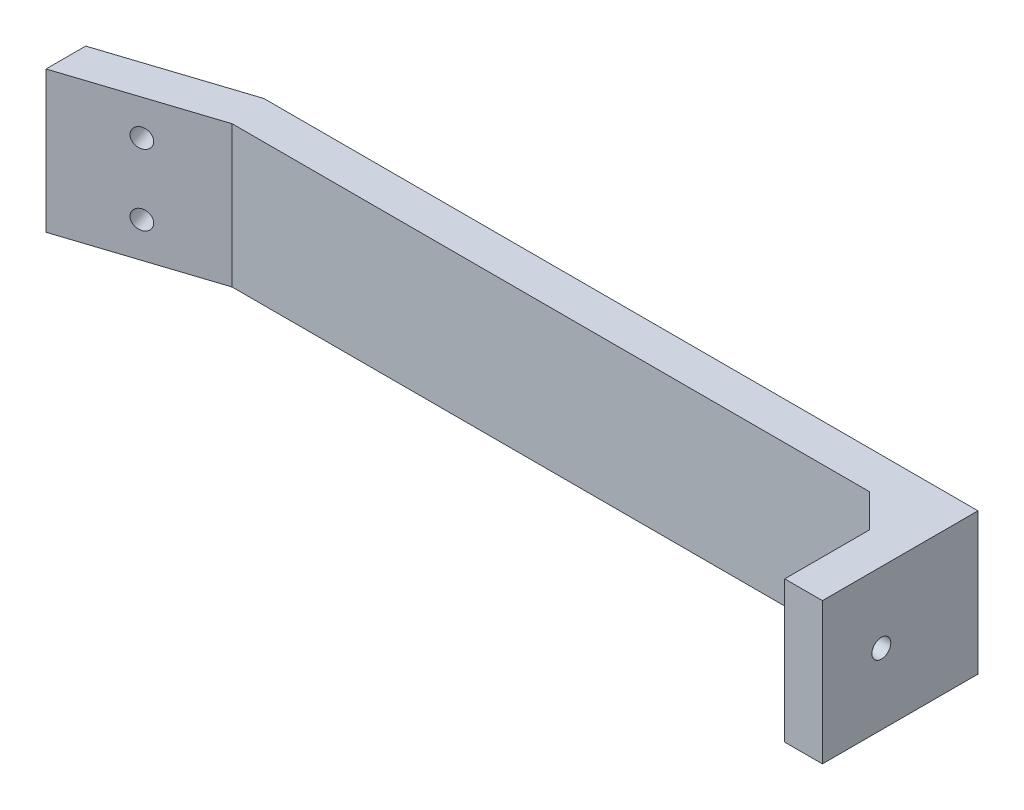
from build123d import *

# Parameters (mm, degrees)
SKETCH1_W           = 180
SKETCH1_H           = 30
BOSS_EXTRUDE1_DEPTH = 50
CUT_EXTRUDE1_DEPTH  = 108.238052948
CUT_EXTRUDE2_DEPTH  = 108.238052948
SKETCH4_W           = 8
SKETCH4_H           = 30
BOSS_EXTRUDE2_DEPTH = 25
SKETCH5_W           = 7
SKETCH5_H           = 5
BOSS_EXTRUDE3_DEPTH = 7
CUT_EXTRUDE3_DEPTH  = 101.444014257
SKETCH7_R           = 2
CUT_EXTRUDE4_DEPTH  = 15
SKETCH8_R           = 2
CUT_EXTRUDE5_DEPTH  = 110.652369188


with BuildPart() as part:
    # Sketch1 → Boss-Extrude1 (new body)
    with BuildSketch(Plane.XY):
        Rectangle(SKETCH1_W, SKETCH1_H)
    extrude(amount=BOSS_EXTRUDE1_DEPTH)

    # Sketch2 → Cut-Extrude1 (cut, through all)
    with BuildSketch(Plane.XZ.offset(15)):
        Polygon((-90, 9.270509831), (-61.468304511, 0), (-90, 0), align=None)
    extrude(amount=-CUT_EXTRUDE1_DEPTH, mode=Mode.SUBTRACT)

    # Sketch3 → Cut-Extrude2 (cut, through all)
    with BuildSketch(Plane.XZ.offset(15)):
        Polygon((-90, 17.682207625), (-60.201228989, 8), (90, 8), (90, 50), (-90, 50), align=None)
    extrude(amount=-CUT_EXTRUDE2_DEPTH, mode=Mode.SUBTRACT)

    # Sketch4 → Boss-Extrude2 (add)
    with BuildSketch(Plane.XY.offset(8)):
        with Locations((86, 0)):
            Rectangle(SKETCH4_W, SKETCH4_H)
    extrude(amount=BOSS_EXTRUDE2_DEPTH)

    # Sketch5 → Boss-Extrude3 (add)
    with BuildSketch(Plane.ZY.offset(-82)):
        with Locations((11.5, -12.5)):
            Rectangle(SKETCH5_W, SKETCH5_H)
        with Locations((11.5, 12.5)):
            Rectangle(SKETCH5_W, SKETCH5_H)
    extrude(amount=BOSS_EXTRUDE3_DEPTH)

    # Sketch6 → Cut-Extrude3 (cut, through all)
    with BuildSketch(Plane.XZ.offset(15)):
        Polygon((75, 8), (82, 15), (75, 15), align=None)
    extrude(amount=-CUT_EXTRUDE3_DEPTH, mode=Mode.SUBTRACT)

    # Sketch7 → Cut-Extrude4 (cut)
    with BuildSketch(Plane.ZY.offset(-82)):
        with Locations((20.5, 0)):
            Circle(SKETCH7_R)
    extrude(amount=-CUT_EXTRUDE4_DEPTH, mode=Mode.SUBTRACT)

    # Sketch8 → Cut-Extrude5 (cut, through all)
    with BuildSketch(Plane(origin=(-5.869700773, 0, -18.065081438), x_dir=(-0.9510565162951532, 0, 0.30901699437494884), z_dir=(-0.30901699437494884, 0, -0.9510565162951532))):
        with Locations((74.92439222, 7.5)):
            Circle(SKETCH8_R)
        with Locations((74.92439222, -7.5)):
            Circle(SKETCH8_R)
    extrude(amount=-CUT_EXTRUDE5_DEPTH, mode=Mode.SUBTRACT)


solid = part.part
